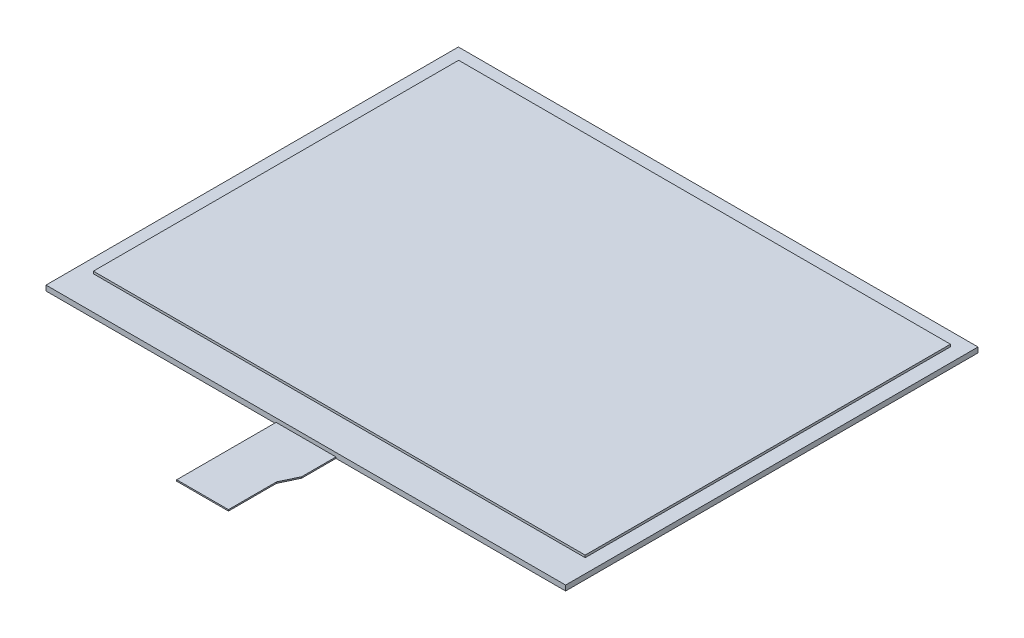
from build123d import *

# Parameters (mm, degrees)
SKETCH1_W           = 125.5
SKETCH1_H           = 99.6
BOSS_EXTRUDE1_DEPTH = 1.25
SKETCH2_W           = 118.78
SKETCH2_H           = 88.22
BOSS_EXTRUDE2_DEPTH = 0.55
BOSS_EXTRUDE3_DEPTH = 0.315


with BuildPart() as part:
    # Sketch1 → Boss-Extrude1 (new body)
    with BuildSketch(Plane(origin=(0, 0, 0), x_dir=(1, 0, 0), z_dir=(0, 1, 0))):
        with Locations((62.75, -49.8)):
            Rectangle(SKETCH1_W, SKETCH1_H)
    extrude(amount=BOSS_EXTRUDE1_DEPTH)

    # Sketch2 → Boss-Extrude2 (add)
    with BuildSketch(Plane(origin=(0, 1.25, 0), x_dir=(1, 0, 0), z_dir=(0, 1, 0))):
        with Locations((62.75, -47.41)):
            Rectangle(SKETCH2_W, SKETCH2_H)
    extrude(amount=BOSS_EXTRUDE2_DEPTH)

    # Sketch3 → Boss-Extrude3 (add)
    with BuildSketch(Plane.XZ):
        Polygon((55.57, 99.6), (70.03, 99.6), (70.03, 107.87048089), (68.07, 112.011323717), (68.07, 123.6), (55.57, 123.6), align=None)
    extrude(amount=-BOSS_EXTRUDE3_DEPTH)


solid = part.part
